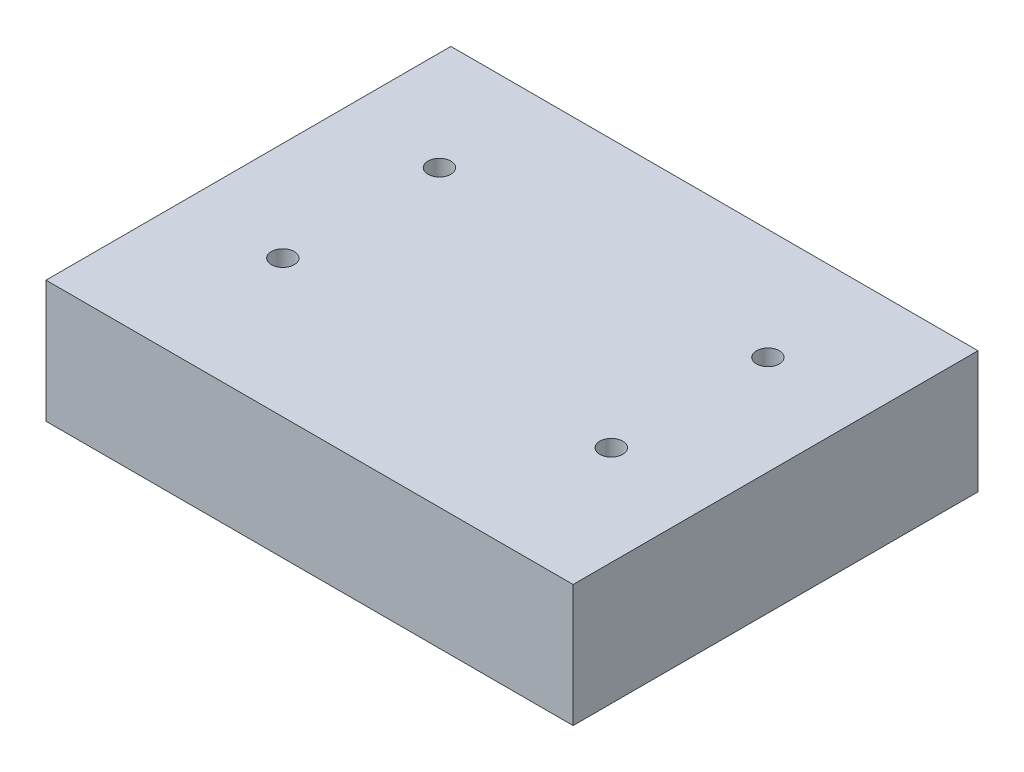
from build123d import *

# Parameters (mm, degrees)
SKETCH2_W           = 3450
SKETCH2_H           = 2650
SKETCH2_R           = 75
BOSS_EXTRUDE1_DEPTH = 800


with BuildPart() as part:
    # Sketch2 → Boss-Extrude1 (new body)
    with BuildSketch(Plane(origin=(0, 0, 0), x_dir=(1, 0, 0), z_dir=(0, 1, 0))):
        Rectangle(SKETCH2_W, SKETCH2_H)
        with Locations(Location((1075, -425, 0), (0, 0, 270))):
            Circle(SKETCH2_R, mode=Mode.SUBTRACT)
        with Locations(Location((1075, 600, 0), (0, 0, 270))):
            Circle(SKETCH2_R, mode=Mode.SUBTRACT)
        with Locations(Location((-1075, -425, 0), (0, 0, 90))):
            Circle(SKETCH2_R, mode=Mode.SUBTRACT)
        with Locations(Location((-1075, 600, 0), (0, 0, 90))):
            Circle(SKETCH2_R, mode=Mode.SUBTRACT)
    extrude(amount=BOSS_EXTRUDE1_DEPTH)


solid = part.part
